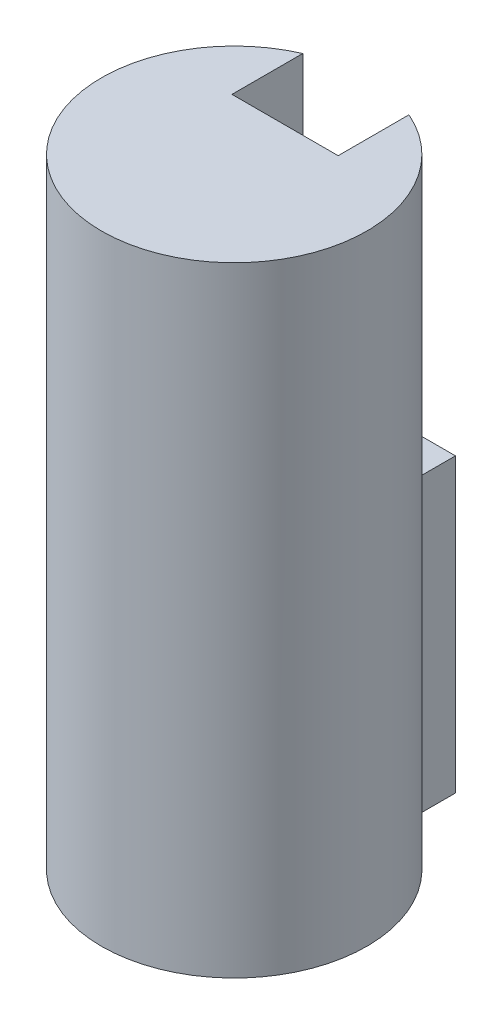
from build123d import *

# Parameters (mm, degrees)
EXTRUDE_2_DEPTH     = 14
EXTRUDE_3_DEPTH     = 6.6
CUT_EXTRUDE_1_DEPTH = 4


with BuildPart() as part:
    # 스케치1 → 보스-돌출2 (new body)
    with BuildSketch(Plane(origin=(0, 0, 0), x_dir=(1, 0, 0), z_dir=(0, 1, 0))):
        with BuildLine():
            ThreePointArc((1, 2.828427125), (0, 3), (-1, 2.828427125))
            ThreePointArc((-1, 2.828427125), (-1.732050808, -2.449489743), (3, 0))
            ThreePointArc((3, 0), (2.449489743, 1.732050808), (1, 2.828427125))
        make_face()
    extrude(amount=EXTRUDE_2_DEPTH)

    # 스케치1<3> → 보스-돌출3 (add)
    with BuildSketch(Plane(origin=(0, 0, 0), x_dir=(1, 0, 0), z_dir=(0, 1, 0))):
        with BuildLine():
            Line((-1, 4), (-1, 2.828427125))
            ThreePointArc((-1, 2.828427125), (0, 3), (1, 2.828427125))
            Line((1, 2.828427125), (1, 4))
            Line((1, 4), (-1, 4))
        make_face()
    extrude(amount=EXTRUDE_3_DEPTH)

    # 스케치2 → 컷-돌출1 (cut)
    with BuildSketch(Plane(origin=(0, 14, 0), x_dir=(1, 0, 0), z_dir=(0, 1, 0))):
        Polygon((-1.2, 1.149545417), (1.2, 1.149545417), (1.2, 2.749545417), (0, 4.828006386), (-1.2, 2.749545417), align=None)
    extrude(amount=-CUT_EXTRUDE_1_DEPTH, mode=Mode.SUBTRACT)


solid = part.part
